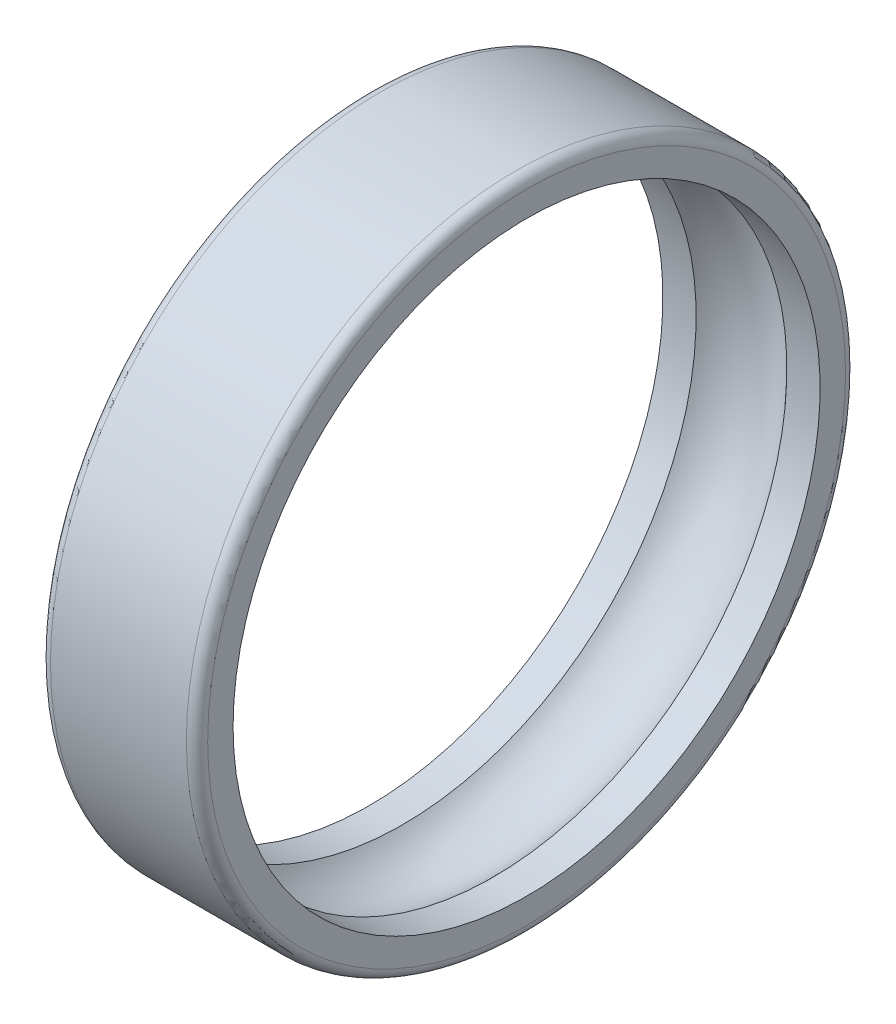
from build123d import *

# Parameters (mm, degrees)
FILLET1_R    = 2.1
SCALE1_SCALE = 0.22
SCALE2_SCALE = 0.2
SCALE3_SCALE = 3.84


with BuildPart() as part:
    # Sketch1 → Revolve1 (revolve)
    with BuildSketch(Plane.XY, mode=Mode.PRIVATE) as revolve1_sk:
        with BuildLine():
            Line((-15.5, 57.89), (-8.94427191, 57.89))
            ThreePointArc((-8.94427191, 57.89), (0, 61.89), (8.94427191, 57.89))
            Line((8.94427191, 57.89), (15.5, 57.89))
            Line((15.5, 57.89), (15.5, 65))
            Line((15.5, 65), (-15.5, 65))
            Line((-15.5, 65), (-15.5, 57.89))
        make_face()
    revolve(revolve1_sk.sketch.rotate(Axis((-92.395721925, 0, 0), (1, 0, 0)), 90), axis=Axis((-92.395721925, 0, 0), (1, 0, 0)))

    # Fillet1
    fillet1_edges = [part.edges().sort_by_distance(p)[0] for p in [
        (15.5, 0, -65),
        (-15.5, 0, -65),
    ]]
    fillet(fillet1_edges, radius=FILLET1_R)


with BuildPart() as part_1:
    # Scale1: scaled about (0, 0, 0)
    add(part.part.scale(SCALE1_SCALE))


with BuildPart() as part_2:
    # Scale2: scaled about (0, 0, 0)
    add(part_1.part.scale(SCALE2_SCALE))


with BuildPart() as part_3:
    # Scale3: scaled about (0, 0, 0)
    add(part_2.part.scale(SCALE3_SCALE))


solid = part_3.part
